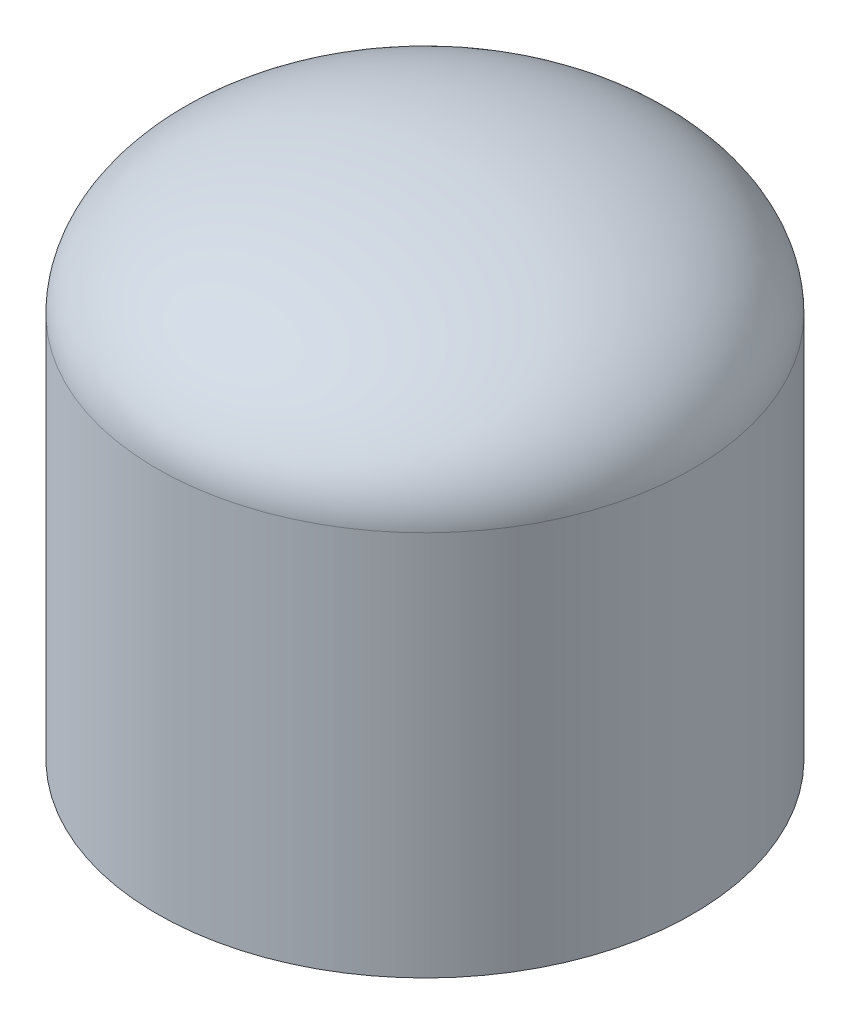
from build123d import *


with BuildPart() as part:
    # Sketch1 → Revolve1 (revolve)
    with BuildSketch(Plane.XY):
        with BuildLine():
            Line((-69.85, 34.925), (-69.85, -65.549018))
            Line((-69.85, -65.549018), (0, -65.549018))
            Line((0, -65.549018), (0, 69.85))
            add(Edge.make_bspline(
                [(0, 69.85), (-69.85, 69.85), (-69.85, 34.925)],
                knots=[1.570796327, 1.570796327, 1.570796327, 3.141592654, 3.141592654, 3.141592654], degree=2, weights=[1, 0.707106781, 1]))
        make_face()
    revolve(axis=Axis((0, 69.85, 0), (0, -1, 0)))


solid = part.part
